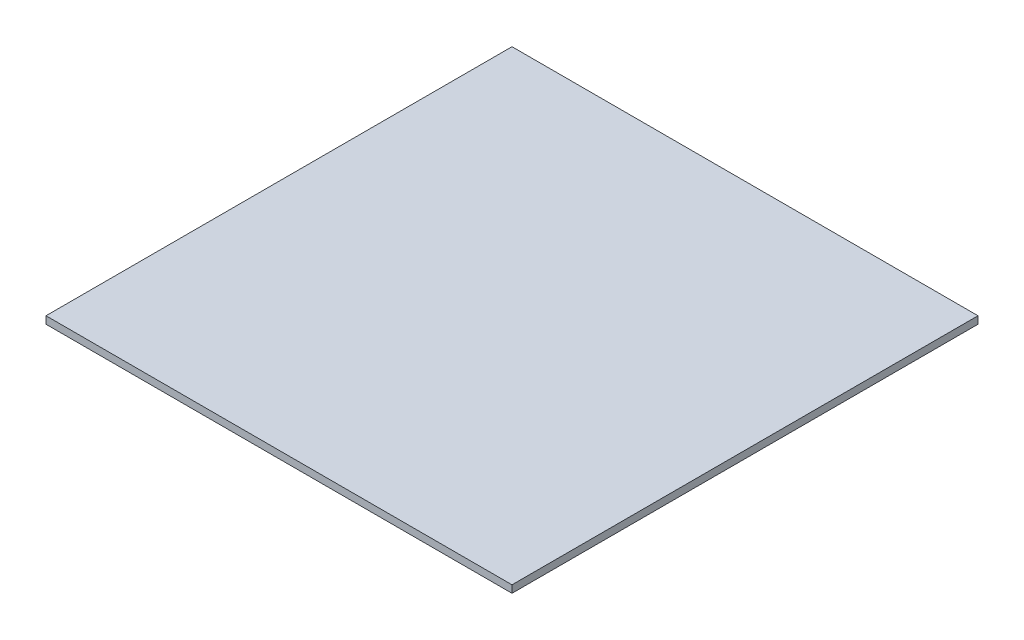
from build123d import *

# Parameters (mm, degrees)
SKETCH1_W           = 360
SKETCH1_H           = 360
BOSS_EXTRUDE1_DEPTH = 5.7


with BuildPart() as part:
    # Sketch1 → Boss-Extrude1 (new body)
    with BuildSketch(Plane(origin=(0, 0, 0), x_dir=(1, 0, 0), z_dir=(0, 1, 0))):
        with Locations((180, 180)):
            Rectangle(SKETCH1_W, SKETCH1_H)
    extrude(amount=BOSS_EXTRUDE1_DEPTH)


solid = part.part
